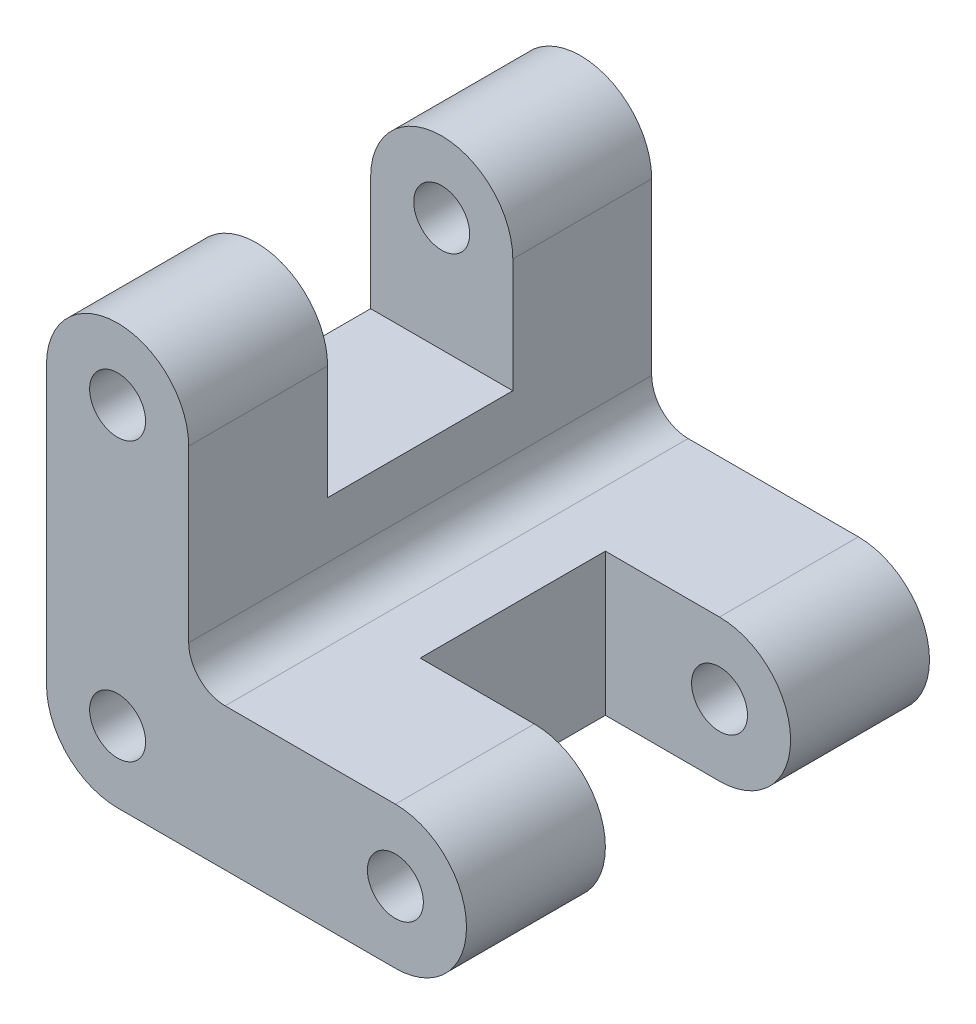
from build123d import *

# Parameters (mm, degrees)
SKETCH1_R           = 7.67
BOSS_EXTRUDE1_DEPTH = 127
FILLET1_R           = 10
SKETCH2_W           = 50.8
SKETCH2_H           = 70.745219222
CUT_EXTRUDE1_DEPTH  = 186.59628229


with BuildPart() as part:
    # Sketch1 → Boss-Extrude1 (new body)
    with BuildSketch(Plane.XY):
        with BuildLine():
            Line((-19.5, 76.2), (-19.5, 0))
            ThreePointArc((-19.5, 0), (-13.788582233, -13.788582233), (0, -19.5))
            Line((0, -19.5), (76.2, -19.5))
            ThreePointArc((76.2, -19.5), (95.7, 0), (76.2, 19.5))
            Line((76.2, 19.5), (19.5, 19.5))
            Line((19.5, 19.5), (19.5, 76.2))
            ThreePointArc((19.5, 76.2), (0, 95.7), (-19.5, 76.2))
        make_face()
        Circle(SKETCH1_R, mode=Mode.SUBTRACT)
        with Locations((0, 76.2)):
            Circle(SKETCH1_R, mode=Mode.SUBTRACT)
        with Locations((76.2, 0)):
            Circle(SKETCH1_R, mode=Mode.SUBTRACT)
    extrude(amount=BOSS_EXTRUDE1_DEPTH)

    # Fillet1
    fillet1_edges = [part.edges().sort_by_distance(p)[0] for p in [
        (19.5, 19.5, 63.5),
    ]]
    fillet(fillet1_edges, radius=FILLET1_R)

    # Sketch2 → Cut-Extrude1 (cut, symmetric)
    with BuildSketch(Plane(origin=(0, 0, 0), x_dir=(0, 0, -1), z_dir=(1, 0, 0))):
        with Locations((-63.5, 80.272609611)):
            Rectangle(SKETCH2_W, SKETCH2_H)
    cut_extrude1 = extrude(amount=CUT_EXTRUDE1_DEPTH, both=True, mode=Mode.SUBTRACT)

    # Mirror1: Cut-Extrude1 across plane
    add(cut_extrude1.mirror(Plane(origin=(0, 0, 0), x_dir=(0, 0, 1), z_dir=(-0.7071067811865512, 0.7071067811865438, 0))), mode=Mode.SUBTRACT)


solid = part.part
